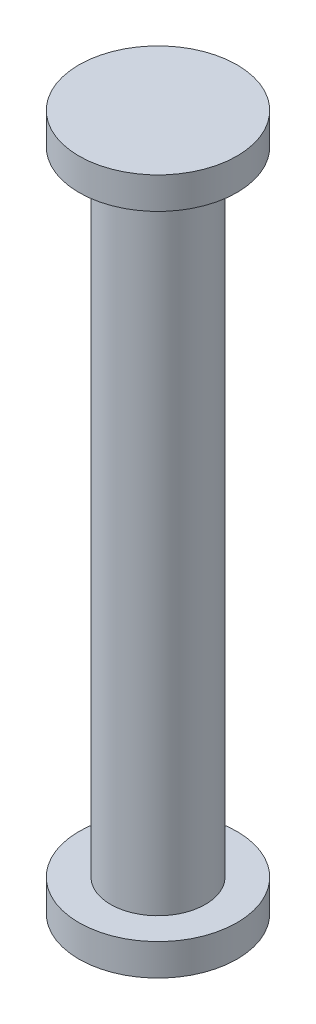
from build123d import *

# Parameters (mm, degrees)
SKETCH2_R           = 7.5
BOSS_EXTRUDE1_DEPTH = 100
SKETCH3_R           = 12.5
BOSS_EXTRUDE2_DEPTH = 5
BOSS_EXTRUDE3_START = 5
SKETCH4_R           = 12.5
BOSS_EXTRUDE3_DEPTH = 5
SCALE1_SCALE        = 0.5


with BuildPart() as part:
    # Sketch2 → Boss-Extrude1 (new body)
    with BuildSketch(Plane(origin=(0, 0, 0), x_dir=(1, 0, 0), z_dir=(0, 1, 0))):
        with Locations(Location((0, 0, 0), (0, 0, 270))):
            Circle(SKETCH2_R)
    extrude(amount=BOSS_EXTRUDE1_DEPTH)

    # Sketch3 → Boss-Extrude2 (add)
    with BuildSketch(Plane(origin=(0, 100, 0), x_dir=(1, 0, 0), z_dir=(0, 1, 0))):
        with Locations(Location((0, 0, 0), (0, 0, 270))):
            Circle(SKETCH3_R)
    extrude(amount=BOSS_EXTRUDE2_DEPTH)

    # Sketch4 → Boss-Extrude3 (add)
    with BuildSketch(Plane.XZ.offset(BOSS_EXTRUDE3_START)):
        with Locations(Location((0, 0, 0), (0, 0, 90))):
            Circle(SKETCH4_R)
    extrude(amount=-BOSS_EXTRUDE3_DEPTH)


with BuildPart() as part_1:
    # Scale1: scaled about (0, 50, 0)
    add(part.part.scale(SCALE1_SCALE).moved(Location((0, 25, 0))))


solid = part_1.part
